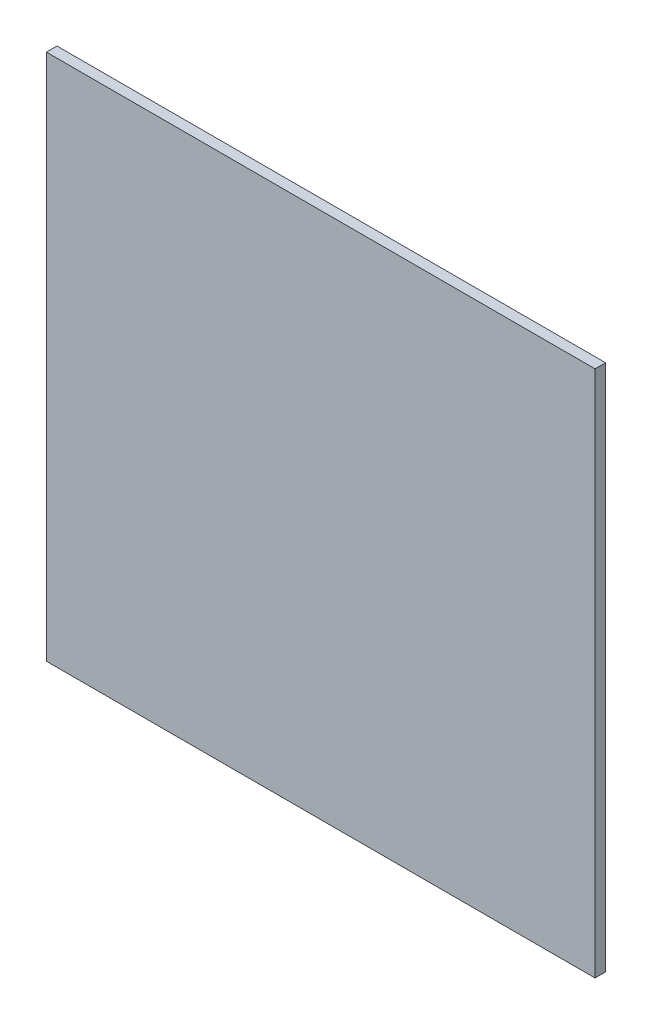
from build123d import *

# Parameters (mm, degrees)
SKETCH1_W           = 312
SKETCH1_H           = 300
BOSS_EXTRUDE1_DEPTH = 6


with BuildPart() as part:
    # Sketch1 → Boss-Extrude1 (new body)
    with BuildSketch(Plane.XY.offset(118.340635288)):
        with Locations((104.196439211, 15.435334025)):
            Rectangle(SKETCH1_W, SKETCH1_H)
    extrude(amount=BOSS_EXTRUDE1_DEPTH)


solid = part.part
